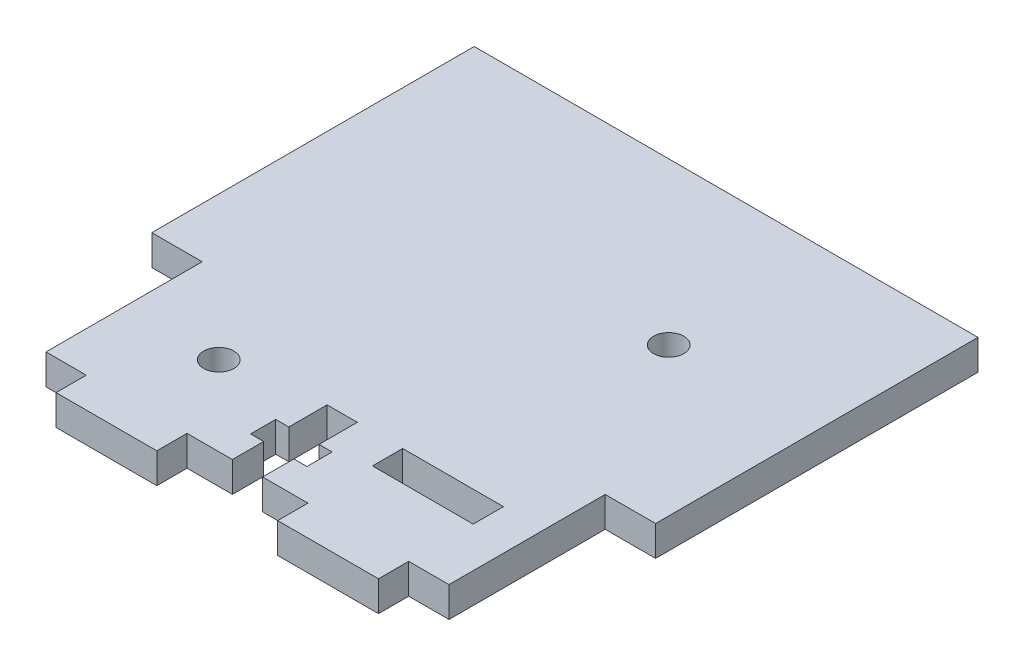
from build123d import *

# Parameters (mm, degrees)
SKETCH2_R           = 1.5
SKETCH2_W           = 10
SKETCH2_H           = 3
BOSS_EXTRUDE1_DEPTH = 3


with BuildPart() as part:
    # Sketch2 → Boss-Extrude1 (new body)
    with BuildSketch(Plane(origin=(0, 0, 0), x_dir=(1, 0, 0), z_dir=(0, 1, 0))):
        Polygon((0, 15.5), (5, 15.5), (5, 47.5), (-45, 47.5), (-45, 15.5), (-40, 15.5), (-40, 0), (-36, 0), (-36, -3), (-26, -3), (-26, 0), (-21.5, 0), (-21.5, 3.1), (-22.8, 3.1), (-22.8, 5.6), (-21.5, 5.6), (-21.5, 9.4), (-18.5, 9.4), (-18.5, 5.6), (-17.2, 5.6), (-17.2, 3.1), (-18.5, 3.1), (-18.5, 0), (-14, 0), (-14, -3), (-4, -3), (-4, 0), (0, 0), align=None)
        with Locations(Location((-30.75, 7.9, 0), (0, 0, 270))):
            Circle(SKETCH2_R, mode=Mode.SUBTRACT)
        with Locations(Location((-9.7, 31.5, 0), (0, 0, 270))):
            Circle(SKETCH2_R, mode=Mode.SUBTRACT)
        with Locations((-9, 7.9)):
            Rectangle(SKETCH2_W, SKETCH2_H, mode=Mode.SUBTRACT)
    extrude(amount=BOSS_EXTRUDE1_DEPTH)


solid = part.part
